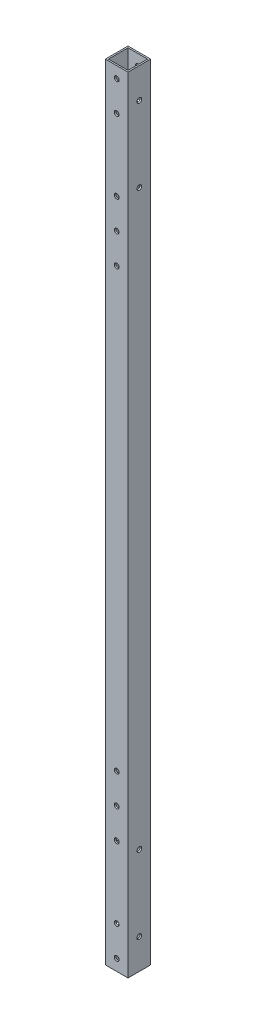
from build123d import *

# Parameters (mm, degrees)
SKETCH_1_W          = 15
SKETCH_1_H          = 15
SKETCH_1_W_2        = 13
SKETCH_1_H_2        = 13
EXTRUDE_1_DEPTH     = 520
SKETCH_2_R          = 1.6
CUT_EXTRUDE_1_DEPTH = 521.270362408
SKETCH_3_R          = 1.6
CUT_EXTRUDE_2_DEPTH = 521.270362408


with BuildPart() as part:
    # 草图1 → 拉伸-薄壁1 (new body)
    with BuildSketch(Plane(origin=(0, 0, 0), x_dir=(1, 0, 0), z_dir=(0, 1, 0))):
        Rectangle(SKETCH_1_W, SKETCH_1_H)
        Rectangle(SKETCH_1_W_2, SKETCH_1_H_2, mode=Mode.SUBTRACT)
    extrude(amount=EXTRUDE_1_DEPTH)

    # 草图2 → 切除-拉伸1 (cut, through all)
    with BuildSketch(Plane.XY.offset(7.5)):
        with Locations((0, 7.5)):
            Circle(SKETCH_2_R)
        with Locations((0, 27.5)):
            Circle(SKETCH_2_R)
        with Locations((0, 75)):
            Circle(SKETCH_2_R)
        with Locations((0, 95)):
            Circle(SKETCH_2_R)
        with Locations((0, 115)):
            Circle(SKETCH_2_R)
        with Locations(Location((0, 405, 0), (0, 0, 180))):
            Circle(SKETCH_2_R)
        with Locations(Location((0, 425, 0), (0, 0, 180))):
            Circle(SKETCH_2_R)
        with Locations(Location((0, 445, 0), (0, 0, 180))):
            Circle(SKETCH_2_R)
        with Locations(Location((0, 492.5, 0), (0, 0, 180))):
            Circle(SKETCH_2_R)
        with Locations(Location((0, 512.5, 0), (0, 0, 180))):
            Circle(SKETCH_2_R)
    extrude(amount=-CUT_EXTRUDE_1_DEPTH, mode=Mode.SUBTRACT)

    # 草图3 → 切除-拉伸2 (cut, through all)
    with BuildSketch(Plane(origin=(7.5, 0, 0), x_dir=(0, 0, -1), z_dir=(1, 0, 0))):
        with Locations((0, 20)):
            Circle(SKETCH_3_R)
        with Locations((0, 70)):
            Circle(SKETCH_3_R)
        with Locations((0, 450)):
            Circle(SKETCH_3_R)
        with Locations((0, 500)):
            Circle(SKETCH_3_R)
    extrude(amount=-CUT_EXTRUDE_2_DEPTH, mode=Mode.SUBTRACT)


solid = part.part
